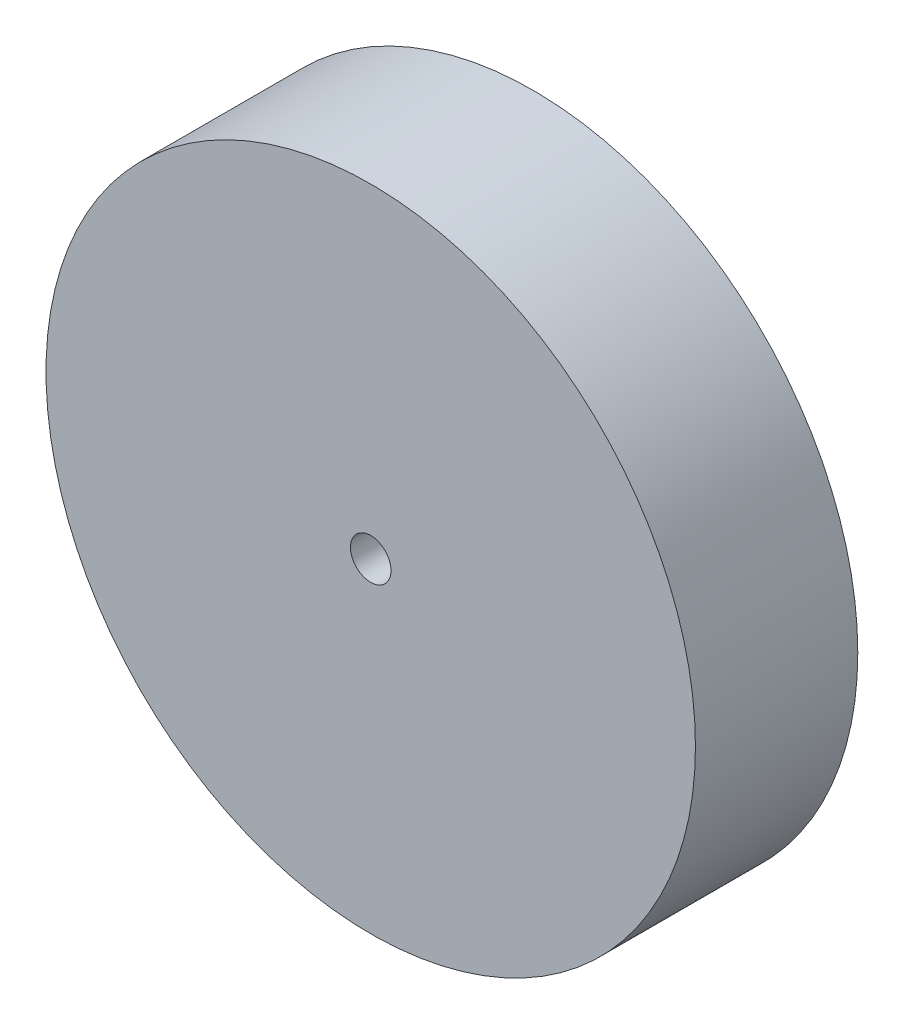
from build123d import *

# Parameters (mm, degrees)
SKETCH1_R           = 63.5
SKETCH1_R_2         = 3.96875
BOSS_EXTRUDE1_DEPTH = 31.75


with BuildPart() as part:
    # Sketch1 → Boss-Extrude1 (new body)
    with BuildSketch(Plane.XY):
        Circle(SKETCH1_R)
        Circle(SKETCH1_R_2, mode=Mode.SUBTRACT)
    extrude(amount=BOSS_EXTRUDE1_DEPTH)


solid = part.part
